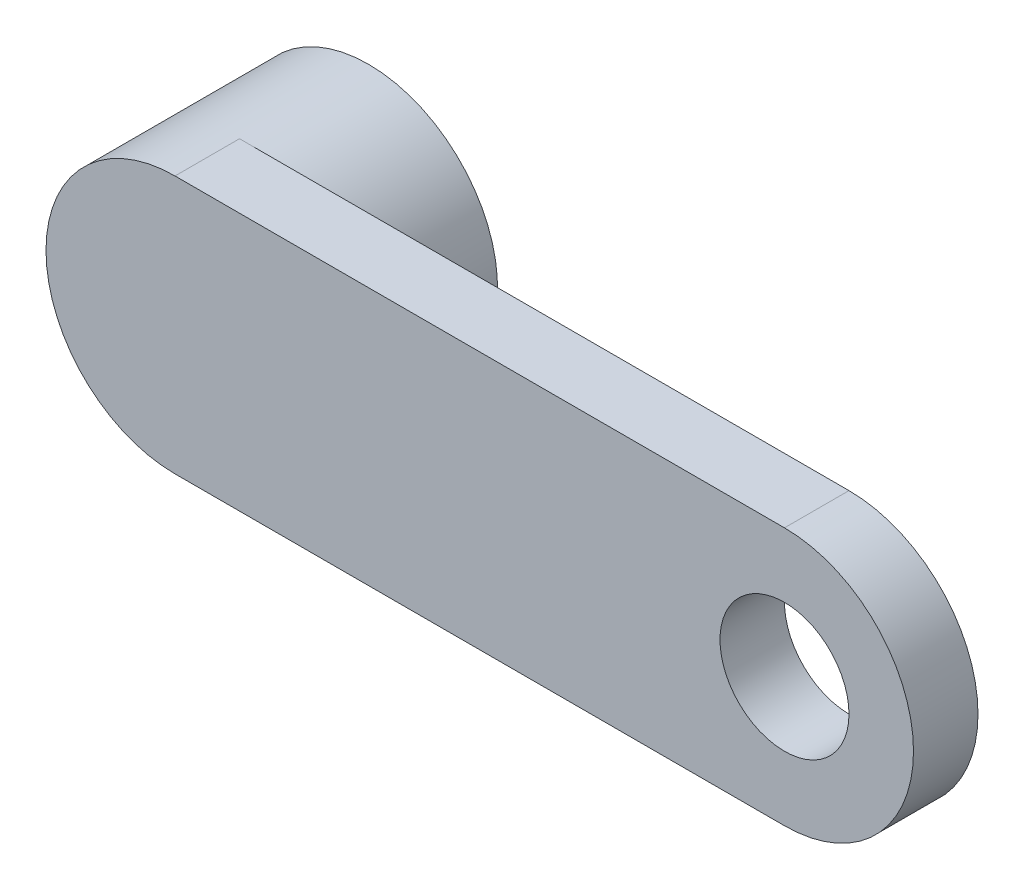
from build123d import *

# Parameters (mm, degrees)
SKETCH1_R           = 1.5875
BOSS_EXTRUDE1_DEPTH = 1.5875
SKETCH2_R           = 3.175
SKETCH2_R_2         = 1.5875
BOSS_EXTRUDE2_DEPTH = 3.175


with BuildPart() as part:
    # Sketch1 → Boss-Extrude1 (new body)
    with BuildSketch(Plane.XY):
        with BuildLine():
            Line((0, 3.175), (15, 3.175))
            ThreePointArc((15, 3.175), (18.175, 0), (15, -3.175))
            Line((15, -3.175), (0, -3.175))
            ThreePointArc((0, -3.175), (-3.175, 0), (0, 3.175))
        make_face()
        with Locations((15, 0)):
            Circle(SKETCH1_R, mode=Mode.SUBTRACT)
    extrude(amount=-BOSS_EXTRUDE1_DEPTH)

    # Sketch2 → Boss-Extrude2 (add)
    with BuildSketch(Plane(origin=(0, 0, -1.5875), x_dir=(-1, 0, 0), z_dir=(0, 0, -1))):
        with Locations(Location((0, 0, 0), (0, 0, 90))):
            Circle(SKETCH2_R)
        Circle(SKETCH2_R_2, mode=Mode.SUBTRACT)
    extrude(amount=BOSS_EXTRUDE2_DEPTH)


solid = part.part
